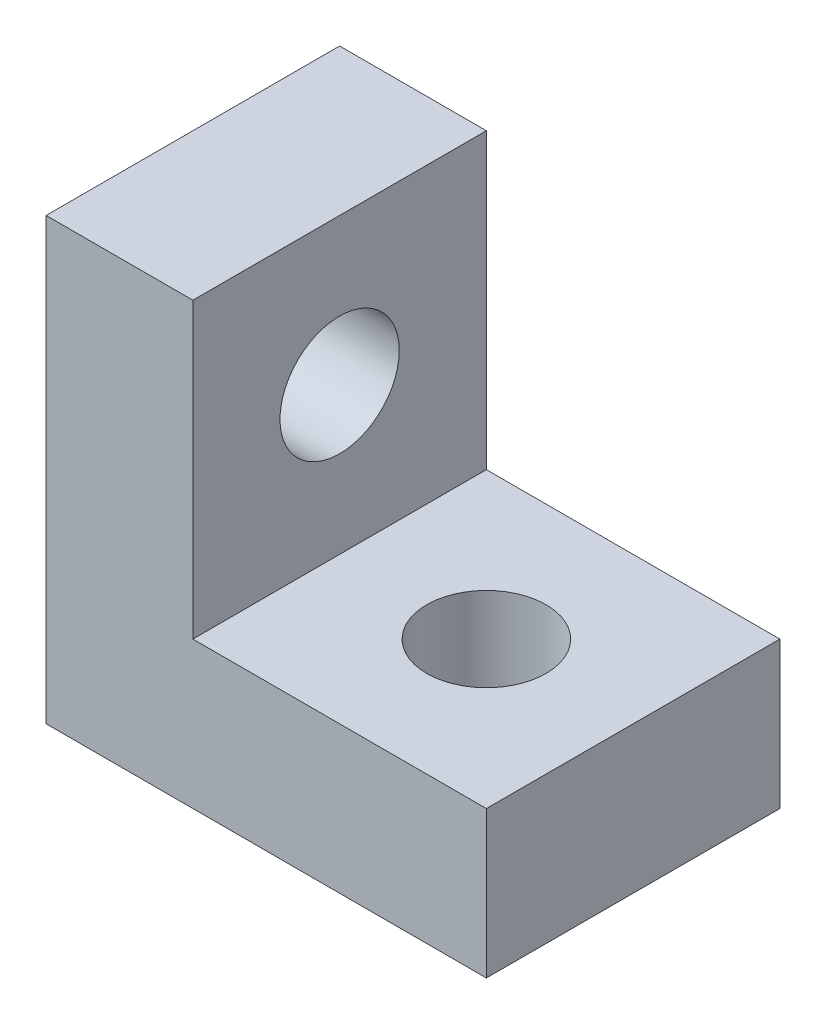
from build123d import *

# Parameters (mm, degrees)
BOSS_EXTRUDE1_DEPTH                        = 12.7
F_13_64_0_20313_DIAMETER_HOLE1_D           = 5.159502
F_13_64_0_20313_DIAMETER_HOLE1_ON_FACE_2_D = 5.159502


with BuildPart() as part:
    # Sketch1 → Boss-Extrude1 (new body)
    with BuildSketch(Plane.XY):
        Polygon((0, 0), (11.162631579, 0), (19.05, 0), (19.05, 6.35), (6.35, 6.35), (6.35, 19.05), (0, 19.05), align=None)
    extrude(amount=BOSS_EXTRUDE1_DEPTH)

    # 13/64 (0.20313) Diameter Hole1 (through all)
    with Locations(Plane(origin=(6.35, 12.7, 6.35), x_dir=(0, 0, 1), z_dir=(1, 0, 0))):
        with Locations((0, 0)):
            Hole(F_13_64_0_20313_DIAMETER_HOLE1_D / 2)

    # 13/64 (0.20313) Diameter Hole1 on face 2 (through all)
    with Locations(Plane(origin=(12.7, 6.35, 6.35), x_dir=(0, 0, 1), z_dir=(0, 1, 0))):
        with Locations((0, 0)):
            Hole(F_13_64_0_20313_DIAMETER_HOLE1_ON_FACE_2_D / 2)


solid = part.part
